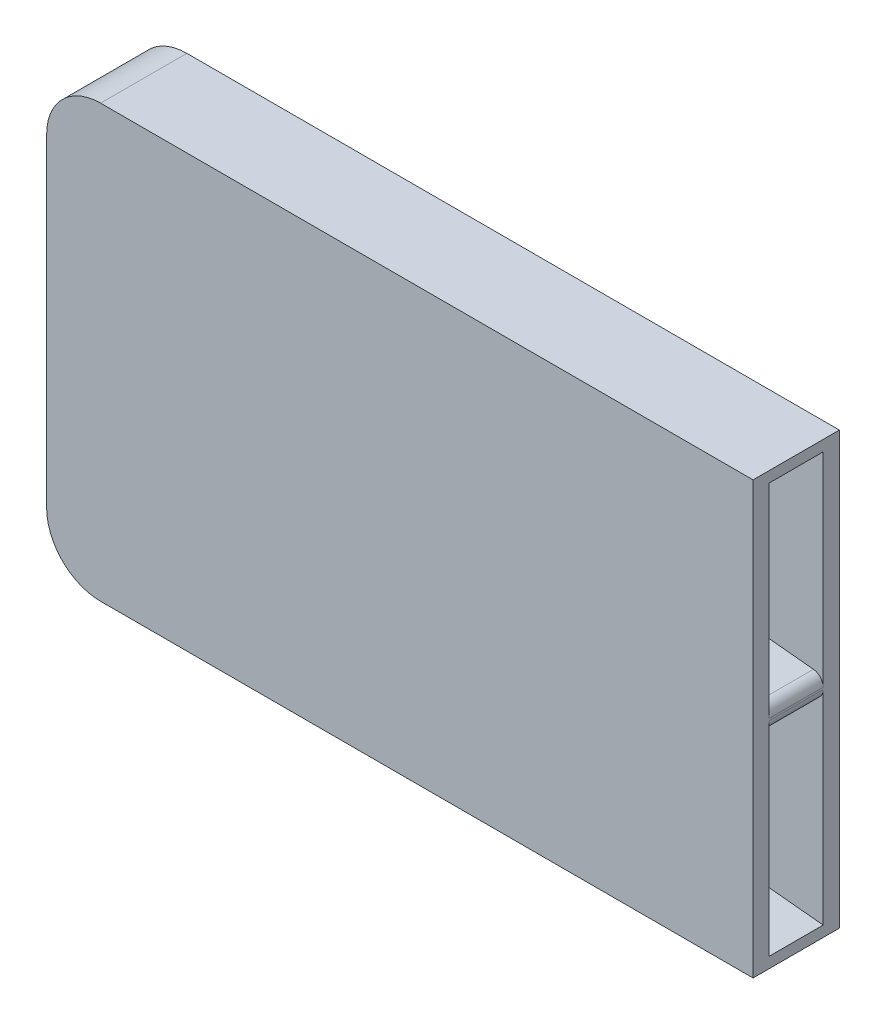
from build123d import *

# Parameters (mm, degrees)
SKETCH1_W           = 65.5
SKETCH1_H           = 40
BOSS_EXTRUDE1_DEPTH = 1.5
BOSS_EXTRUDE2_DEPTH = 5
BOSS_EXTRUDE3_START = 5
SKETCH1_5_W         = 65.5
SKETCH1_5_H         = 40
BOSS_EXTRUDE3_DEPTH = 1.5
FILLET1_R           = 5
FILLET2_R           = 1


with BuildPart() as part:
    # Sketch1 → Boss-Extrude1 (new body)
    with BuildSketch(Plane.XY):
        with Locations((32.75, 20)):
            Rectangle(SKETCH1_W, SKETCH1_H)
    extrude(amount=-BOSS_EXTRUDE1_DEPTH)

    # Sketch1<3> → Boss-Extrude2 (add)
    with BuildSketch(Plane.XY):
        Polygon((0, 7.5), (0, 0), (65.5, 0), (65.5, 1), align=None)
        Polygon((0, 27.5), (0, 12.5), (65.5, 19), (65.5, 21), align=None)
        Polygon((0, 40), (0, 32.5), (65.5, 39), (65.5, 40), align=None)
    extrude(amount=BOSS_EXTRUDE2_DEPTH)

    # Sketch1<5> → Boss-Extrude3 (add)
    with BuildSketch(Plane.XY.offset(BOSS_EXTRUDE3_START)):
        with Locations((32.75, 20)):
            Rectangle(SKETCH1_5_W, SKETCH1_5_H)
    extrude(amount=BOSS_EXTRUDE3_DEPTH)

    # Fillet1
    fillet1_edges = [part.edges().sort_by_distance(p)[0] for p in [
        (0, 40, 2.5),
        (0, 0, 2.5),
    ]]
    fillet(fillet1_edges, radius=FILLET1_R)

    # Fillet2
    fillet2_edges = [part.edges().sort_by_distance(p)[0] for p in [
        (65.5, 21, 2.5),
        (65.5, 19, 2.5),
    ]]
    fillet(fillet2_edges, radius=FILLET2_R)


solid = part.part
